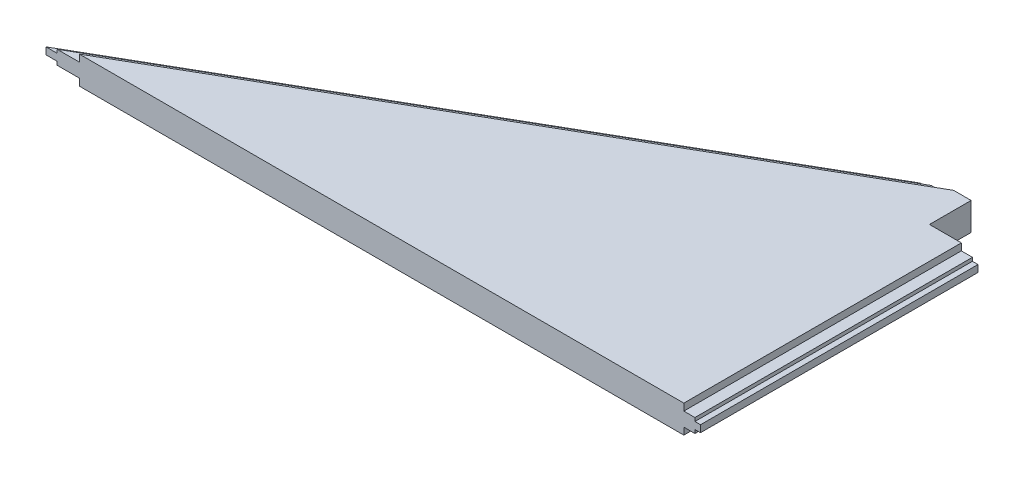
from build123d import *

# Parameters (mm, degrees)
BOSS_EXTRUDE1_DEPTH      = 6.35
BOSS_EXTRUDE1_DEPTH_BACK = 6.35
SKETCH2_W                = 292.995908675
SKETCH2_H                = 3.175
CUT_EXTRUDE1_DEPTH       = 38.1
SKETCH3_W                = 146.05
SKETCH3_H                = 3.175
CUT_EXTRUDE2_DEPTH       = 38.1
CUT_EXTRUDE3_DEPTH       = 3.175
CUT_EXTRUDE4_DEPTH       = 3.175
SKETCH6_W                = 5.08
SKETCH6_H                = 3.175
CUT_EXTRUDE5_DEPTH       = 157.099
CUT_EXTRUDE6_DEPTH       = 339.217
CUT_EXTRUDE6_DEPTH_BACK  = 157.099
SKETCH9_W                = 50.8
SKETCH9_H                = 19.05
CUT_EXTRUDE7_DEPTH       = 21.59
SKETCH11_W               = 6.965000048
SKETCH11_H               = 19.05
CUT_EXTRUDE10_DEPTH      = 366.729881683


with BuildPart() as part:
    # Sketch1 → Boss-Extrude1 (new, two sides: drawn at the far end of the back side and taken through both)
    with BuildSketch(Plane(origin=(0, 0, 0), x_dir=(1, 0, 0), z_dir=(0, 1, 0)).offset(-BOSS_EXTRUDE1_DEPTH_BACK)):
        Polygon((-406.4, 0), (0, 0), (0, 146.05), (-152.4, 146.05), align=None)
    extrude(amount=BOSS_EXTRUDE1_DEPTH + BOSS_EXTRUDE1_DEPTH_BACK)

    # Sketch2 → Cut-Extrude1 (cut)
    with BuildSketch(Plane(origin=(-100.979614843, 0, -175.616721465), x_dir=(-0.8669063030575352, 0, 0.49847112425808277), z_dir=(-0.4984711242580827, 0, -0.8669063030575351))):
        with Locations((205.812767226, 4.7625)):
            Rectangle(SKETCH2_W, SKETCH2_H)
        with Locations((205.812767226, -4.7625)):
            Rectangle(SKETCH2_W, SKETCH2_H)
    extrude(amount=-CUT_EXTRUDE1_DEPTH, mode=Mode.SUBTRACT)

    # Sketch3 → Cut-Extrude2 (cut)
    with BuildSketch(Plane(origin=(0, 0, 0), x_dir=(0, 0, -1), z_dir=(1, 0, 0))):
        with Locations((73.025, 4.7625)):
            Rectangle(SKETCH3_W, SKETCH3_H)
        with Locations((73.025, -4.7625)):
            Rectangle(SKETCH3_W, SKETCH3_H)
    extrude(amount=-CUT_EXTRUDE2_DEPTH, mode=Mode.SUBTRACT)

    # Sketch4 → Cut-Extrude3 (cut)
    with BuildSketch(Plane(origin=(0, 6.35, 0), x_dir=(1, 0, 0), z_dir=(0, 1, 0))):
        Polygon((-133.408250166, 113.020869854), (-75.966284694, 146.05), (-152.4, 146.05), align=None)
    extrude(amount=-CUT_EXTRUDE3_DEPTH, mode=Mode.SUBTRACT)

    # Sketch5 → Cut-Extrude4 (cut)
    with BuildSketch(Plane.XZ.offset(6.35)):
        Polygon((-133.408250166, -113.020869854), (-75.966284694, -146.05), (-152.4, -146.05), align=None)
    extrude(amount=-CUT_EXTRUDE4_DEPTH, mode=Mode.SUBTRACT)

    # Sketch6 → Cut-Extrude5 (cut)
    with BuildSketch(Plane(origin=(0, 0, -146.05), x_dir=(-1, 0, 0), z_dir=(0, 0, -1))):
        Polygon((0, -3.175), (38.1, -3.175), (38.1, -1.5875), (35.56, -1.5875), (35.56, 1.5875), (38.1, 1.5875), (38.1, 3.175), (0, 3.175), align=None)
        with Locations((40.64, -4.7625)):
            Rectangle(SKETCH6_W, SKETCH6_H)
        with Locations((40.64, 4.7625)):
            Rectangle(SKETCH6_W, SKETCH6_H)
    extrude(amount=-CUT_EXTRUDE5_DEPTH, mode=Mode.SUBTRACT)

    # Sketch8 → Cut-Extrude6 (cut, two sides: drawn at the far end of the back side and taken through both)
    with BuildSketch(Plane(origin=(-51.420385157, 0, 29.566721465), x_dir=(0.49847112425808243, 0, 0.8669063030575355), z_dir=(-0.8669063030575355, 0, 0.49847112425808243)).offset(-CUT_EXTRUDE6_DEPTH_BACK)):
        Polygon((-164.478664898, 1.5875), (-164.478664898, 3.175), (-159.398664898, 3.175), (-159.398664898, 6.35), (-164.478664898, 6.35), (-202.578664898, 6.35), (-202.578664898, -6.35), (-164.478664898, -6.35), (-159.398664898, -6.35), (-159.398664898, -3.175), (-164.478664898, -3.175), (-164.478664898, -1.5875), (-167.018664898, -1.5875), (-167.018664898, 1.5875), align=None)
    extrude(amount=CUT_EXTRUDE6_DEPTH + CUT_EXTRUDE6_DEPTH_BACK, mode=Mode.SUBTRACT)

    # Sketch9 → Cut-Extrude7 (cut)
    with BuildSketch(Plane(origin=(0, 6.35, 0), x_dir=(1, 0, 0), z_dir=(0, 1, 0))):
        with Locations((-25.4, 136.525)):
            Rectangle(SKETCH9_W, SKETCH9_H)
    extrude(amount=-CUT_EXTRUDE7_DEPTH, mode=Mode.SUBTRACT)

    # Sketch11 → Cut-Extrude10 (cut, through all)
    with BuildSketch(Plane(origin=(0, 6.35, 0), x_dir=(1, 0, 0), z_dir=(0, 1, 0))):
        with Locations((-54.282500024, 136.525)):
            Rectangle(SKETCH11_W, SKETCH11_H)
    extrude(amount=-CUT_EXTRUDE10_DEPTH, mode=Mode.SUBTRACT)


solid = part.part
